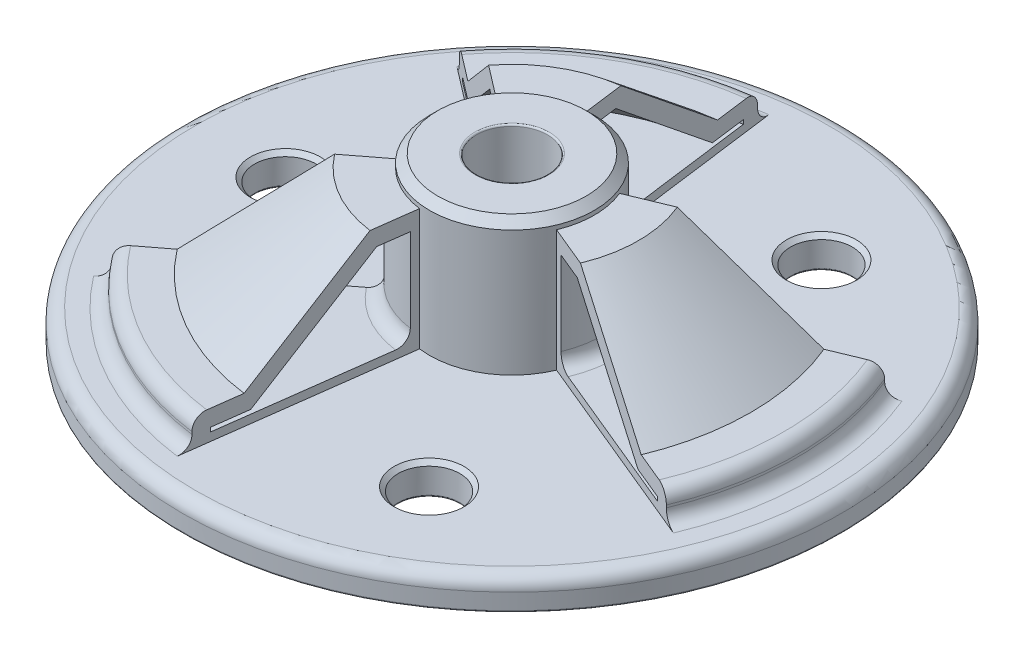
from build123d import *

# Parameters (mm, degrees)
CBORE_FOR_10_SOCKET_HEAD_CAP_SCREW1_AT_COUNT = 2
CBORE_FOR_10_SOCKET_HEAD_CAP_SCREW1_AT_PITCH = 60.491874454
CBORE_FOR_10_SOCKET_HEAD_CAP_SCREW1_2_COUNT  = 2
CBORE_FOR_10_SOCKET_HEAD_CAP_SCREW1_2_PITCH  = 60.491874454
REVOLVE_THIN1_ANGLE                          = 45
CIRPATTERN1_COUNT                            = 3
SKETCH8_R                                    = 7.9375
SKETCH8_R_2                                  = 5.461
BOSS_EXTRUDE1_DEPTH                          = 12.7
BOSS_EXTRUDE1_DRAFT                          = 1
FILLET1_R                                    = 2.032
FILLET2_R                                    = 0.254
CHAMFER1_SIZE                                = 1.27


with BuildPart() as part:
    # Sketch1 → Revolve1 (revolve)
    with BuildSketch(Plane.XY, mode=Mode.PRIVATE) as revolve1_sk:
        Polygon((5.461, 25.4), (12.7, 25.4), (12.7, 4.7625), (50.8, 4.7625), (50.8, 0), (5.461, 0), align=None)
    revolve(revolve1_sk.sketch.rotate(Axis((0, 0, 0), (0, 1, 0)), 90), axis=Axis((0, 0, 0), (0, 1, 0)))

    # Sketch6 → CBORE for #10 Socket Head Cap Screw1 (revolve, cut)
    with BuildSketch(Plane(origin=(17.4625, 4.7625, -30.245937227), x_dir=(0, 0, 1), z_dir=(1, 0, 0))):
        Polygon((0, 0), (0, 4.7625), (2.8067, 4.7625), (2.8067, 4.826), (4.7625, 4.826), (4.7625, 0.635), (5.3975, 0), align=None)
    cbore_for_10_socket_head_cap_screw1 = revolve(axis=Axis((17.4625, 11.1125, -30.245937227), (0, -1, 0)), mode=Mode.SUBTRACT)

    # CBORE for #10 Socket Head Cap Screw1 at: CBORE for #10 Socket Head Cap Screw1 ×2
    with Locations(*[Vector(-0.8660254037844386, 0, 0.5000000000000002) * (i * CBORE_FOR_10_SOCKET_HEAD_CAP_SCREW1_AT_PITCH) for i in range(1, CBORE_FOR_10_SOCKET_HEAD_CAP_SCREW1_AT_COUNT)]):
        add(cbore_for_10_socket_head_cap_screw1, mode=Mode.SUBTRACT)

    # CBORE for _10 Socket Head Cap Screw1 2: CBORE for #10 Socket Head Cap Screw1 ×2
    with Locations(*[(0, 0, i * CBORE_FOR_10_SOCKET_HEAD_CAP_SCREW1_2_PITCH) for i in range(1, CBORE_FOR_10_SOCKET_HEAD_CAP_SCREW1_2_COUNT)]):
        add(cbore_for_10_socket_head_cap_screw1, mode=Mode.SUBTRACT)

    # Sketch7 → Revolve-Thin1 (revolve, symmetric)
    with BuildSketch(Plane.XY) as revolve_thin1_sk:
        Polygon((11.43, 3.4925), (11.43, 23.495), (19.506621615, 23.495), (36.807010349, 9.2075), (43.970388734, 9.2075), (43.970388734, 3.4925), align=None)
        Polygon((13.97, 6.0325), (13.97, 20.955), (18.593378385, 20.955), (35.893767119, 6.6675), (41.430388734, 6.6675), (41.430388734, 6.0325), align=None, mode=Mode.SUBTRACT)
    revolve_thin1 = revolve(axis=Axis((0, 25.4, 0), (0, -1, 0)), revolution_arc=REVOLVE_THIN1_ANGLE / 2)
    revolve_thin1 = revolve_thin1 + revolve(revolve_thin1_sk.sketch, axis=Axis((0, 25.4, 0), (0, 1, 0)), revolution_arc=REVOLVE_THIN1_ANGLE / 2)

    # CirPattern1: Revolve-Thin1 ×3 about axis
    cirpattern1_axis = Axis((0, 0, 0), (0, 1, 0))
    for i in range(1, CIRPATTERN1_COUNT):
        add(revolve_thin1.rotate(cirpattern1_axis, i * 360 / CIRPATTERN1_COUNT))


with BuildPart() as boss_extrude1_tool:
    # Sketch8 → Boss-Extrude1 (with draft: the straight prism first)
    with BuildSketch(Plane.XZ):
        Circle(SKETCH8_R)
        with Locations(Location((0, 0, 0), (0, 0, 270))):
            Circle(SKETCH8_R_2, mode=Mode.SUBTRACT)
    extrude(amount=BOSS_EXTRUDE1_DEPTH)
    # Boss-Extrude1: the draft: its side faces are tilted about the plane it starts from
    boss_extrude1_sides = [boss_extrude1_tool.faces().sort_by_distance(p)[0] for p in [
        (-7.9375, -6.35, 0),
        (0, -6.35, 5.461),
    ]]
    draft(boss_extrude1_sides, Plane.XZ, BOSS_EXTRUDE1_DRAFT)


with BuildPart() as part_1:
    add(part.part)

    # Boss-Extrude1: add boss_extrude1_tool
    add(boss_extrude1_tool.part)

    # Fillet1
    fillet1_edges = [part_1.edges().sort_by_distance(p)[0] for p in [
        (-21.985194367, 4.7625, -38.079473658),
        (-21.985194367, 9.2075, -38.079473658),
        (-6.985, 6.0325, -12.098374891),
        (43.970388734, 4.7625, 0),
        (43.970388734, 9.2075, 0),
        (13.97, 6.0325, 0),
        (0, 4.7625, 50.8),
        (-21.985194367, 4.7625, 38.079473658),
        (-21.985194367, 9.2075, 38.079473658),
        (-6.985, 6.0325, 12.098374891),
    ]]
    fillet(fillet1_edges, radius=FILLET1_R)

    # Fillet2
    fillet2_edges = [part_1.edges().sort_by_distance(p)[0] for p in [
        (-7.715820675, -12.7, 0),
        (-7.9375, 0, 0),
        (0, -12.7, 5.682679325),
        (17.4625, 0, -35.008437227),
        (17.4625, 0, 25.483437227),
        (-34.925, 0, -4.7625),
        (0, 0, 50.8),
        (0, 25.4, 5.461),
    ]]
    fillet(fillet2_edges, radius=FILLET2_R)

    # Chamfer1
    chamfer1_edges = [part_1.edges().sort_by_distance(p)[0] for p in [
        (0, 25.4, 12.7),
    ]]
    chamfer(chamfer1_edges, length=CHAMFER1_SIZE)


solid = part_1.part
